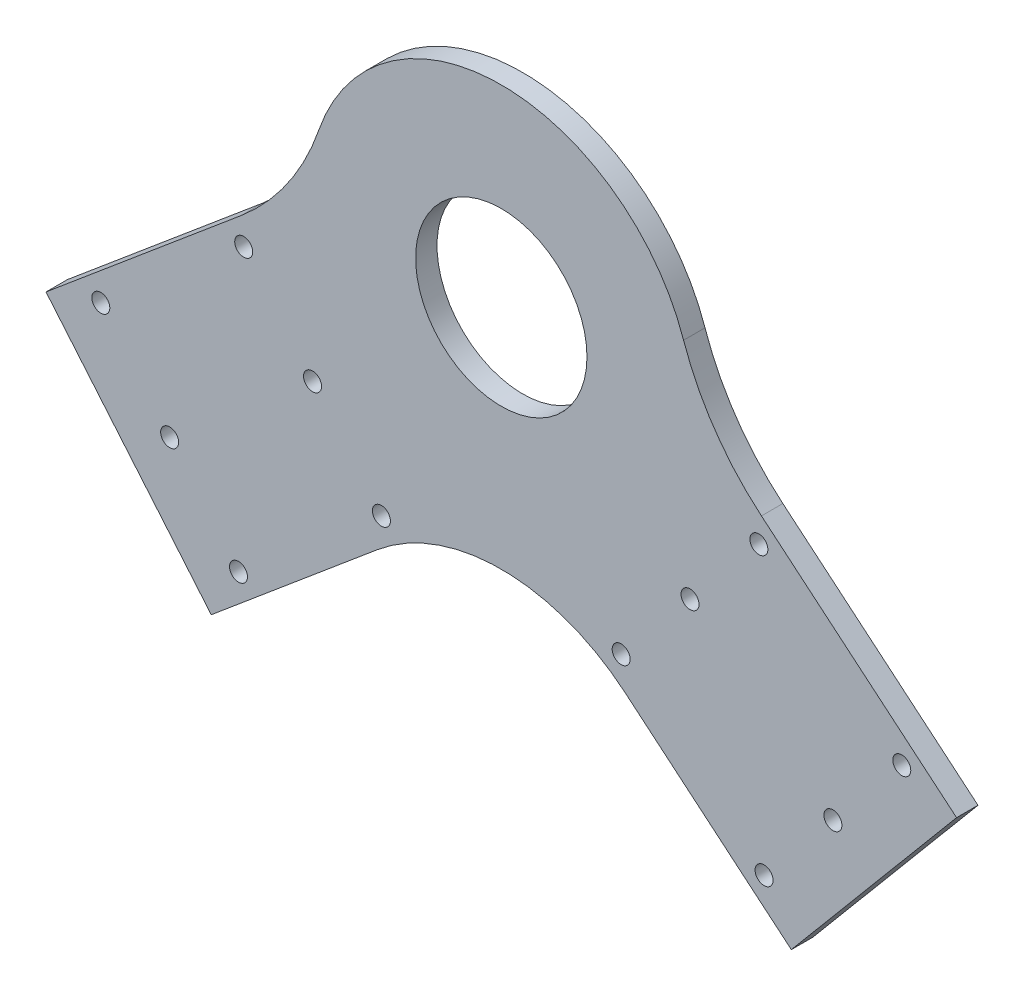
from build123d import *

# Parameters (mm, degrees)
SKETCH1_R           = 2.1
SKETCH1_R_2         = 20
BOSS_EXTRUDE1_DEPTH = 5
FILLET1_R           = 60
FILLET3_R           = 45


with BuildPart() as part:
    # Sketch1 → Boss-Extrude1 (new body)
    with BuildSketch(Plane.XY):
        with BuildLine():
            Line((-106.261095469, -50.001427337), (-67.693838888, -95.964093924))
            Line((-67.693838888, -95.964093924), (0, -39.16221868))
            Line((0, -39.16221868), (67.693838888, -95.964093924))
            Line((67.693838888, -95.964093924), (106.261095469, -50.001427337))
            Line((106.261095469, -50.001427337), (44.97754002, 1.421581438))
            ThreePointArc((44.97754002, 1.421581438), (0, 45), (-44.97754002, 1.421581438))
            Line((-44.97754002, 1.421581438), (-106.261095469, -50.001427337))
        make_face()
        with Locations((-61.332221397, -84.099026587)):
            Circle(SKETCH1_R, mode=Mode.SUBTRACT)
        with Locations((-77.40191164, -64.947915509)):
            Circle(SKETCH1_R, mode=Mode.SUBTRACT)
        with Locations((-93.471601882, -45.796804431)):
            Circle(SKETCH1_R, mode=Mode.SUBTRACT)
        with Locations((-27.978646344, -56.112054061)):
            Circle(SKETCH1_R, mode=Mode.SUBTRACT)
        with Locations((-44.048336586, -36.960942983)):
            Circle(SKETCH1_R, mode=Mode.SUBTRACT)
        with Locations((-60.118026828, -17.809831905)):
            Circle(SKETCH1_R, mode=Mode.SUBTRACT)
        Circle(SKETCH1_R_2, mode=Mode.SUBTRACT)
        with Locations((60.118026828, -17.809831905)):
            Circle(SKETCH1_R, mode=Mode.SUBTRACT)
        with Locations((61.332221397, -84.099026587)):
            Circle(SKETCH1_R, mode=Mode.SUBTRACT)
        with Locations((77.40191164, -64.947915509)):
            Circle(SKETCH1_R, mode=Mode.SUBTRACT)
        with Locations((27.978646344, -56.112054061)):
            Circle(SKETCH1_R, mode=Mode.SUBTRACT)
        with Locations((44.048336586, -36.960942983)):
            Circle(SKETCH1_R, mode=Mode.SUBTRACT)
        with Locations((93.471601882, -45.796804431)):
            Circle(SKETCH1_R, mode=Mode.SUBTRACT)
    extrude(amount=BOSS_EXTRUDE1_DEPTH)

    # Fillet1
    fillet1_edges = [part.edges().sort_by_distance(p)[0] for p in [
        (44.97754002, 1.421581438, 2.5),
        (-44.97754002, 1.421581438, 2.5),
    ]]
    fillet(fillet1_edges, radius=FILLET1_R)

    # Fillet3
    fillet3_edges = [part.edges().sort_by_distance(p)[0] for p in [
        (0, -39.16221868, 2.5),
    ]]
    fillet(fillet3_edges, radius=FILLET3_R)


solid = part.part
